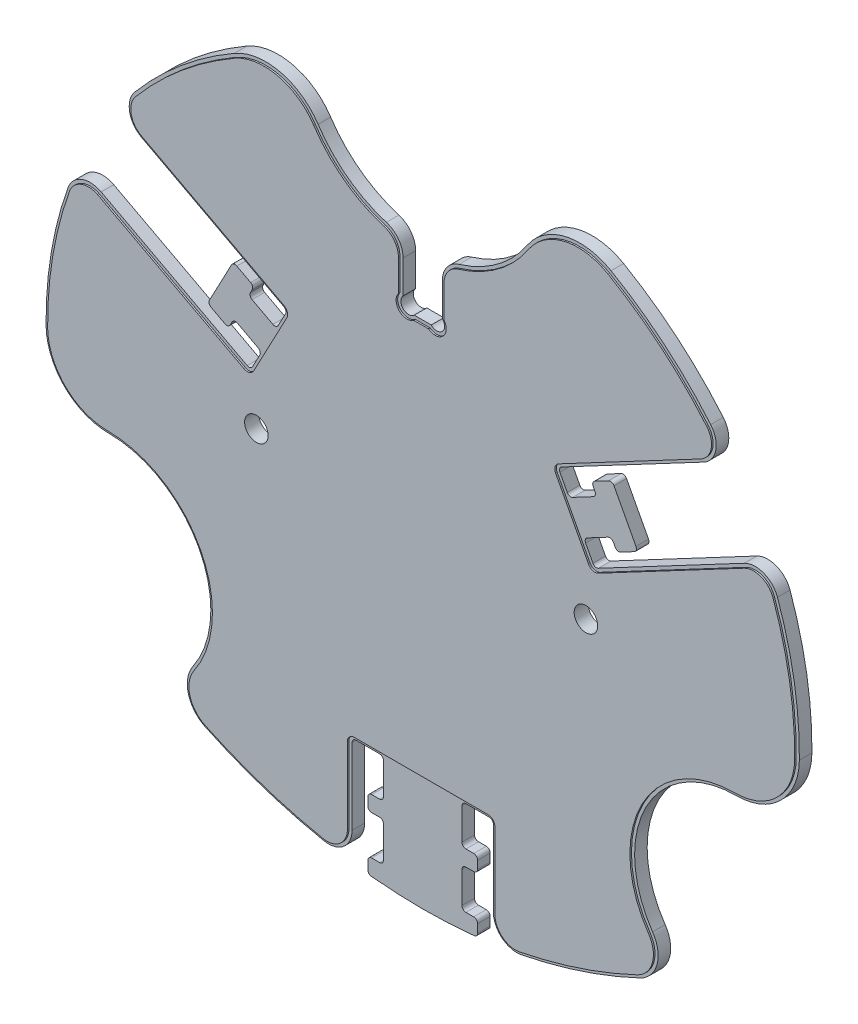
from build123d import *

# Parameters (mm, degrees)
ESQUISSE1_R        = 1.5
BOSS_EXTRU_1_DEPTH = 1.6
CONG_5_R           = 0.5
CONG_6_R           = 3
ESQUISSE2_R        = 1.5
BOSS_EXTRU_2_DEPTH = 0.2


with BuildPart() as part:
    # Esquisse1 → Boss.-Extru.1 (new body)
    with BuildSketch(Plane.XY):
        with BuildLine():
            Line((43.93252618, 60.214170281), (21.932288163, 48.556814165))
            Line((21.932288163, 48.556814165), (20.527667832, 51.207670955))
            Line((20.527667832, 51.207670955), (24.062143552, 53.080498064))
            Line((24.062143552, 53.080498064), (24.764453718, 51.755069669))
            Line((24.764453718, 51.755069669), (27.415310509, 53.159690001))
            Line((27.415310509, 53.159690001), (24.137863068, 59.345022512))
            Line((24.137863068, 59.345022512), (21.487006277, 57.94040218))
            Line((21.487006277, 57.94040218), (22.189316443, 56.614973785))
            Line((22.189316443, 56.614973785), (18.654840723, 54.742146676))
            Line((18.654840723, 54.742146676), (17.250220391, 57.393003466))
            Line((17.250220391, 57.393003466), (38.968768579, 68.901099441))
            ThreePointArc((38.968768579, 68.901099441), (32.204229924, 76.468217437), (23.999826553, 82.443836508))
            ThreePointArc((23.999826553, 82.443836508), (18.170194084, 83.303460357), (13.333333333, 79.937699528))
            ThreePointArc((13.333333333, 79.937699528), (8.647603473, 75.320273347), (2.5, 72.978551673))
            Line((2.5, 72.978551673), (2.5, 66.414213562))
            ThreePointArc((2.5, 66.414213562), (2.5, 65), (1.085786438, 65))
            Line((1.085786438, 65), (-1.085786438, 65))
            ThreePointArc((-1.085786438, 65), (-2.5, 65), (-2.5, 66.414213562))
            Line((-2.5, 66.414213562), (-2.5, 72.978551673))
            ThreePointArc((-2.5, 72.978551673), (-8.647603473, 75.320273347), (-13.333333333, 79.937699528))
            ThreePointArc((-13.333333333, 79.937699528), (-18.170194084, 83.303460357), (-23.999826553, 82.443836508))
            ThreePointArc((-23.999826553, 82.443836508), (-32.204229924, 76.468217437), (-38.968768579, 68.901099441))
            Line((-38.968768579, 68.901099441), (-17.250220391, 57.393003466))
            Line((-17.250220391, 57.393003466), (-18.654840723, 54.742146676))
            Line((-18.654840723, 54.742146676), (-22.189316443, 56.614973785))
            Line((-22.189316443, 56.614973785), (-21.487006277, 57.94040218))
            Line((-21.487006277, 57.94040218), (-24.137863068, 59.345022512))
            Line((-24.137863068, 59.345022512), (-27.415310509, 53.159690001))
            Line((-27.415310509, 53.159690001), (-24.764453718, 51.755069669))
            Line((-24.764453718, 51.755069669), (-24.062143552, 53.080498064))
            Line((-24.062143552, 53.080498064), (-20.527667832, 51.207670955))
            Line((-20.527667832, 51.207670955), (-21.932288163, 48.556814165))
            Line((-21.932288163, 48.556814165), (-43.93252618, 60.214170281))
            ThreePointArc((-43.93252618, 60.214170281), (-47.018924497, 50.536222449), (-47.999653106, 40.425500406))
            ThreePointArc((-47.999653106, 40.425500406), (-45.630453057, 34.816867204), (-40, 32.5))
            ThreePointArc((-40, 32.5), (-28.491975972, 25.5469317), (-29.294117647, 12.125443536))
            ThreePointArc((-29.294117647, 12.125443536), (-29.863230602, 8.819310514), (-27.714945916, 6.242630863))
            ThreePointArc((-27.714945916, 6.242630863), (-18.57076725, 2.724943245), (-9, 0.629580769))
            Line((-9, 0.629580769), (-9, 14.380120465))
            Line((-9, 14.380120465), (-5, 14.380120465))
            Line((-5, 14.380120465), (-5, 9.380120465))
            Line((-5, 9.380120465), (-7, 9.380120465))
            Line((-7, 9.380120465), (-7, 7.380120465))
            Line((-7, 7.380120465), (-5, 7.380120465))
            Line((-5, 7.380120465), (-5, 2.380120465))
            Line((-5, 2.380120465), (-7, 2.380120465))
            Line((-7, 2.380120465), (-7, 0.380120465))
            ThreePointArc((-7, 0.380120465), (0, 0), (7, 0.380120465))
            Line((7, 0.380120465), (7, 2.380120465))
            Line((7, 2.380120465), (5, 2.380120465))
            Line((5, 2.380120465), (5, 7.380120465))
            Line((5, 7.380120465), (7, 7.380120465))
            Line((7, 7.380120465), (7, 9.380120465))
            Line((7, 9.380120465), (5, 9.380120465))
            Line((5, 9.380120465), (5, 14.380120465))
            Line((5, 14.380120465), (9, 14.380120465))
            Line((9, 14.380120465), (9, 0.629580769))
            ThreePointArc((9, 0.629580769), (18.57076725, 2.724943245), (27.714945916, 6.242630863))
            ThreePointArc((27.714945916, 6.242630863), (29.863230602, 8.819310514), (29.294117647, 12.125443536))
            ThreePointArc((29.294117647, 12.125443536), (28.491975972, 25.5469317), (40, 32.5))
            ThreePointArc((40, 32.5), (45.630453057, 34.816867204), (47.999653106, 40.425500406))
            ThreePointArc((47.999653106, 40.425500406), (47.018924497, 50.536222449), (43.93252618, 60.214170281))
        make_face()
        with Locations((-21, 42.594010768)):
            Circle(ESQUISSE1_R, mode=Mode.SUBTRACT)
        with Locations(Location((21, 42.594010768, 0), (0, 0, 180))):
            Circle(ESQUISSE1_R, mode=Mode.SUBTRACT)
    extrude(amount=BOSS_EXTRU_1_DEPTH)

    # Congé5
    cong_5_edges = [part.edges().sort_by_distance(p)[0] for p in [
        (-21.932288163, 48.556814165, 0.8),
        (-20.527667832, 51.207670955, 0.8),
        (-24.062143552, 53.080498064, 0.8),
        (-24.764453718, 51.755069669, 0.8),
        (-27.415310509, 53.159690001, 0.8),
        (-24.137863068, 59.345022512, 0.8),
        (-21.487006277, 57.94040218, 0.8),
        (-22.189316443, 56.614973785, 0.8),
        (-18.654840723, 54.742146676, 0.8),
        (-17.250220391, 57.393003466, 0.8),
        (17.250220391, 57.393003466, 0.8),
        (18.654840723, 54.742146676, 0.8),
        (22.189316443, 56.614973785, 0.8),
        (21.487006277, 57.94040218, 0.8),
        (24.137863068, 59.345022512, 0.8),
        (27.415310509, 53.159690001, 0.8),
        (24.764453718, 51.755069669, 0.8),
        (24.062143552, 53.080498064, 0.8),
        (20.527667832, 51.207670955, 0.8),
        (21.932288163, 48.556814165, 0.8),
        (9, 14.380120465, 0.8),
        (5, 14.380120465, 0.8),
        (5, 9.380120465, 0.8),
        (7, 9.380120465, 0.8),
        (7, 7.380120465, 0.8),
        (5, 7.380120465, 0.8),
        (5, 2.380120465, 0.8),
        (7, 2.380120465, 0.8),
        (7, 0.380120465, 0.8),
        (-7, 0.380120465, 0.8),
        (-7, 2.380120465, 0.8),
        (-5, 2.380120465, 0.8),
        (-5, 7.380120465, 0.8),
        (-7, 7.380120465, 0.8),
        (-7, 9.380120465, 0.8),
        (-5, 9.380120465, 0.8),
        (-5, 14.380120465, 0.8),
        (-9, 14.380120465, 0.8),
    ]]
    fillet(cong_5_edges, radius=CONG_5_R)

    # Congé6
    cong_6_edges = [part.edges().sort_by_distance(p)[0] for p in [
        (-43.93252618, 60.214170281, 0.8),
        (-38.968768579, 68.901099441, 0.8),
        (-2.5, 72.978551673, 0.8),
        (2.5, 72.978551673, 0.8),
        (38.968768579, 68.901099441, 0.8),
        (43.93252618, 60.214170281, 0.8),
        (9, 0.629580769, 0.8),
        (-9, 0.629580769, 0.8),
    ]]
    fillet(cong_6_edges, radius=CONG_6_R)

    # Esquisse2 → Boss.-Extru.2 (add)
    with BuildSketch(Plane.XY.offset(1.6)):
        with BuildLine():
            Line((17.130876207, 56.76391129), (21.344737203, 48.811340919))
            ThreePointArc((21.344737203, 48.811340919), (21.875627564, 48.372430406), (22.561380339, 48.437469981))
            Line((22.561380339, 48.437469981), (41.166232536, 58.295699124))
            ThreePointArc((41.166232536, 58.295699124), (43.324675322, 58.421989777), (44.832304267, 56.872189932))
            ThreePointArc((44.832304267, 56.872189932), (46.941562163, 48.772822572), (47.59967045, 40.429225386))
            ThreePointArc((47.59967045, 40.429225386), (45.348930404, 35.101023844), (40, 32.9))
            ThreePointArc((40, 32.9), (28.137882925, 25.732991137), (28.964705882, 11.898534106))
            ThreePointArc((28.964705882, 11.898534106), (29.476907542, 8.923014386), (27.543451325, 6.6040027))
            ThreePointArc((27.543451325, 6.6040027), (20.178701166, 3.651319452), (12.506137634, 1.62903062))
            ThreePointArc((12.506137634, 1.62903062), (10.350145135, 2.169818051), (9.4, 4.179290351))
            Line((9.4, 4.179290351), (9.4, 13.880120465))
            ThreePointArc((9.4, 13.880120465), (9.136396103, 14.516516568), (8.5, 14.780120465))
            Line((8.5, 14.780120465), (-8.5, 14.780120465))
            ThreePointArc((-8.5, 14.780120465), (-9.136396103, 14.516516568), (-9.4, 13.880120465))
            Line((-9.4, 13.880120465), (-9.4, 4.179290351))
            ThreePointArc((-9.4, 4.179290351), (-10.350145135, 2.169818051), (-12.506137634, 1.62903062))
            ThreePointArc((-12.506137634, 1.62903062), (-20.178701166, 3.651319452), (-27.543451325, 6.6040027))
            ThreePointArc((-27.543451325, 6.6040027), (-29.476907542, 8.923014386), (-28.964705882, 11.898534106))
            ThreePointArc((-28.964705882, 11.898534106), (-28.137882925, 25.732991137), (-40, 32.9))
            ThreePointArc((-40, 32.9), (-45.348930404, 35.101023844), (-47.59967045, 40.429225386))
            ThreePointArc((-47.59967045, 40.429225386), (-46.941562163, 48.772822572), (-44.832304267, 56.872189932))
            ThreePointArc((-44.832304267, 56.872189932), (-43.324675322, 58.421989777), (-41.166232536, 58.295699124))
            Line((-41.166232536, 58.295699124), (-22.561380339, 48.437469981))
            ThreePointArc((-22.561380339, 48.437469981), (-21.875627564, 48.372430406), (-21.344737203, 48.811340919))
            Line((-21.344737203, 48.811340919), (-17.130876207, 56.76391129))
            ThreePointArc((-17.130876207, 56.76391129), (-17.065836632, 57.449664065), (-17.504747145, 57.980554427))
            Line((-17.504747145, 57.980554427), (-35.623679269, 67.581307113))
            ThreePointArc((-35.623679269, 67.581307113), (-36.958790528, 69.38373682), (-36.394186988, 71.55456564))
            ThreePointArc((-36.394186988, 71.55456564), (-30.555163706, 77.373296343), (-23.799835225, 82.09742134))
            ThreePointArc((-23.799835225, 82.09742134), (-18.26168438, 82.914063996), (-13.666666667, 79.716591209))
            ThreePointArc((-13.666666667, 79.716591209), (-9.786030036, 75.621727742), (-4.747368421, 73.084182352))
            ThreePointArc((-4.747368421, 73.084182352), (-3.412316822, 72.145201681), (-2.9, 70.595498823))
            Line((-2.9, 70.595498823), (-2.9, 66.56402835))
            ThreePointArc((-2.9, 66.56402835), (-2.782842712, 64.717157288), (-0.93597165, 64.6))
            Line((-0.93597165, 64.6), (0.93597165, 64.6))
            ThreePointArc((0.93597165, 64.6), (2.782842712, 64.717157288), (2.9, 66.56402835))
            Line((2.9, 66.56402835), (2.9, 70.595498823))
            ThreePointArc((2.9, 70.595498823), (3.412316822, 72.145201681), (4.747368421, 73.084182352))
            ThreePointArc((4.747368421, 73.084182352), (9.786030036, 75.621727742), (13.666666667, 79.716591209))
            ThreePointArc((13.666666667, 79.716591209), (18.26168438, 82.914063996), (23.799835225, 82.09742134))
            ThreePointArc((23.799835225, 82.09742134), (30.555163706, 77.373296343), (36.394186988, 71.55456564))
            ThreePointArc((36.394186988, 71.55456564), (36.958790528, 69.38373682), (35.623679269, 67.581307113))
            Line((35.623679269, 67.581307113), (17.504747145, 57.980554427))
            ThreePointArc((17.504747145, 57.980554427), (17.065836632, 57.449664065), (17.130876207, 56.76391129))
        make_face()
        with Locations((-21, 42.594010768)):
            Circle(ESQUISSE2_R, mode=Mode.SUBTRACT)
        with Locations(Location((21, 42.594010768, 0), (0, 0, 180))):
            Circle(ESQUISSE2_R, mode=Mode.SUBTRACT)
    extrude(amount=BOSS_EXTRU_2_DEPTH)


solid = part.part
